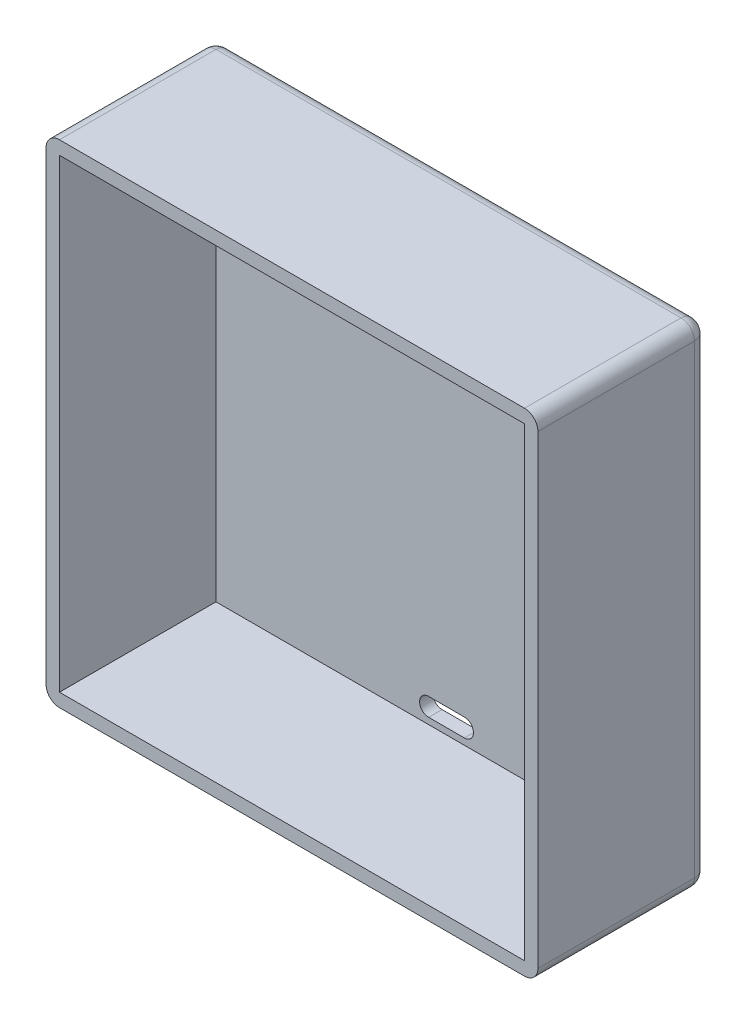
from build123d import *

# Parameters (mm, degrees)
SKETCH_1_W          = 110
SKETCH_1_H          = 110
EXTRUDE_1_DEPTH     = 38
SKETCH_3_W          = 104
SKETCH_3_H          = 104
CUT_EXTRUDE_1_DEPTH = 32
FILLET_1_R          = 3
FILLET_2_R          = 3
CUT_EXTRUDE_2_DEPTH = 85.107074613
FILLET_3_R          = 3
CUT_EXTRUDE_4_DEPTH = 1
CUT_EXTRUDE_5_DEPTH = 3
SKETCH_13_W         = 104
SKETCH_13_H         = 104
CUT_EXTRUDE_6_DEPTH = 3


with BuildPart() as part:
    # 草图1 → 凸台-拉伸1 (new body)
    with BuildSketch(Plane.XY):
        Rectangle(SKETCH_1_W, SKETCH_1_H)
    extrude(amount=EXTRUDE_1_DEPTH)

    # 草图3 → 切除-拉伸1 (cut)
    with BuildSketch(Plane.XY.offset(38)):
        Rectangle(SKETCH_3_W, SKETCH_3_H)
    extrude(amount=-CUT_EXTRUDE_1_DEPTH, mode=Mode.SUBTRACT)

    # 圆角1
    fillet_1_edges = [part.edges().sort_by_distance(p)[0] for p in [
        (55, -55, 19),
        (55, 55, 19),
    ]]
    fillet(fillet_1_edges, radius=FILLET_1_R)

    # 圆角2
    fillet_2_edges = [part.edges().sort_by_distance(p)[0] for p in [
        (-55, 55, 19),
        (-55, -55, 19),
    ]]
    fillet(fillet_2_edges, radius=FILLET_2_R)

    # 草图4 → 切除-拉伸2 (cut, through all)
    with BuildSketch(Plane.XY.offset(6)):
        with BuildLine():
            Line((-3.909141934, -47.255379726), (3.909141934, -47.255379726))
            ThreePointArc((3.909141934, -47.255379726), (5.159141934, -48.505379726), (3.909141934, -49.755379726))
            Line((3.909141934, -49.755379726), (-3.909141934, -49.755379726))
            ThreePointArc((-3.909141934, -49.755379726), (-5.159141934, -48.505379726), (-3.909141934, -47.255379726))
        make_face()
    extrude(amount=-CUT_EXTRUDE_2_DEPTH, mode=Mode.SUBTRACT)

    # 圆角3
    fillet_3_edges = [part.edges().sort_by_distance(p)[0] for p in [
        (55, 0, 0),
        (54.121320344, 54.121320344, 0),
        (54.121320344, -54.121320344, 0),
        (0, -55, 0),
        (-55, 0, 0),
        (0, 55, 0),
        (-54.121320344, 54.121320344, 0),
        (-54.121320344, -54.121320344, 0),
    ]]
    fillet(fillet_3_edges, radius=FILLET_3_R)

    # 草图7 → 切除-拉伸4 (cut)
    with BuildSketch(Plane(origin=(0, 0, 0), x_dir=(-1, 0, 0), z_dir=(0, 0, -1))):
        with BuildLine():
            Line((27.351581896, -16.692025534), (72.045241502, -16.692025534))
            ThreePointArc((72.045241502, -16.692025534), (78.315018535, -22.961802567), (72.045241502, -29.231579599))
            Line((72.045241502, -29.231579599), (27.351581896, -29.231579599))
            ThreePointArc((27.351581896, -29.231579599), (21.081804864, -22.961802567), (27.351581896, -16.692025534))
        make_face()
        with BuildLine():
            Line((27.389277991, -35.286565578), (72.382937597, -35.286565578))
            ThreePointArc((72.382937597, -35.286565578), (78.652714629, -41.556342611), (72.382937597, -47.826119643))
            Line((72.382937597, -47.826119643), (27.389277991, -47.826119643))
            ThreePointArc((27.389277991, -47.826119643), (21.119500958, -41.556342611), (27.389277991, -35.286565578))
        make_face()
        with BuildLine():
            Line((26.949815907, -0.968873845), (71.943475513, -0.968873845))
            ThreePointArc((71.943475513, -0.968873845), (78.213252546, -7.238650877), (71.943475513, -13.50842791))
            Line((71.943475513, -13.50842791), (26.949815907, -13.50842791))
            ThreePointArc((26.949815907, -13.50842791), (20.680038875, -7.238650877), (26.949815907, -0.968873845))
        make_face()
        with BuildLine():
            Line((-74.834862022, -16.710464099), (-29.841202416, -16.710464099))
            ThreePointArc((-29.841202416, -16.710464099), (-23.571425383, -22.980241131), (-29.841202416, -29.250018164))
            Line((-29.841202416, -29.250018164), (-74.834862022, -29.250018164))
            ThreePointArc((-74.834862022, -29.250018164), (-81.104639054, -22.980241131), (-74.834862022, -16.710464099))
        make_face()
        with BuildLine():
            Line((-74.497165928, -35.305004142), (-29.503506322, -35.305004142))
            ThreePointArc((-29.503506322, -35.305004142), (-23.233729289, -41.574781175), (-29.503506322, -47.844558208))
            Line((-29.503506322, -47.844558208), (-74.497165928, -47.844558208))
            ThreePointArc((-74.497165928, -47.844558208), (-80.76694296, -41.574781175), (-74.497165928, -35.305004142))
        make_face()
        with BuildLine():
            Line((-74.936628011, -0.987312409), (-29.942968405, -0.987312409))
            ThreePointArc((-29.942968405, -0.987312409), (-23.673191373, -7.257089442), (-29.942968405, -13.526866474))
            Line((-29.942968405, -13.526866474), (-74.936628011, -13.526866474))
            ThreePointArc((-74.936628011, -13.526866474), (-81.206405044, -7.257089442), (-74.936628011, -0.987312409))
        make_face()
    extrude(amount=-CUT_EXTRUDE_4_DEPTH, mode=Mode.SUBTRACT)

    # 草图10 → 切除-拉伸5 (cut)
    with BuildSketch(Plane(origin=(0, 0, 0), x_dir=(-1, 0, 0), z_dir=(0, 0, -1))):
        with BuildLine():
            Line((-3.558455997, -46.531518088), (4.441544003, -46.531518088))
            ThreePointArc((4.441544003, -46.531518088), (6.466487551, -48.556461636), (4.441544003, -50.581405184))
            Line((4.441544003, -50.581405184), (-3.558455997, -50.581405184))
            ThreePointArc((-3.558455997, -50.581405184), (-5.583399545, -48.556461636), (-3.558455997, -46.531518088))
        make_face()
    extrude(amount=-CUT_EXTRUDE_5_DEPTH, mode=Mode.SUBTRACT)

    # 草图13 → 切除-拉伸6 (cut)
    with BuildSketch(Plane.XY.offset(6)):
        Rectangle(SKETCH_13_W, SKETCH_13_H)
    extrude(amount=-CUT_EXTRUDE_6_DEPTH, mode=Mode.SUBTRACT)


solid = part.part
